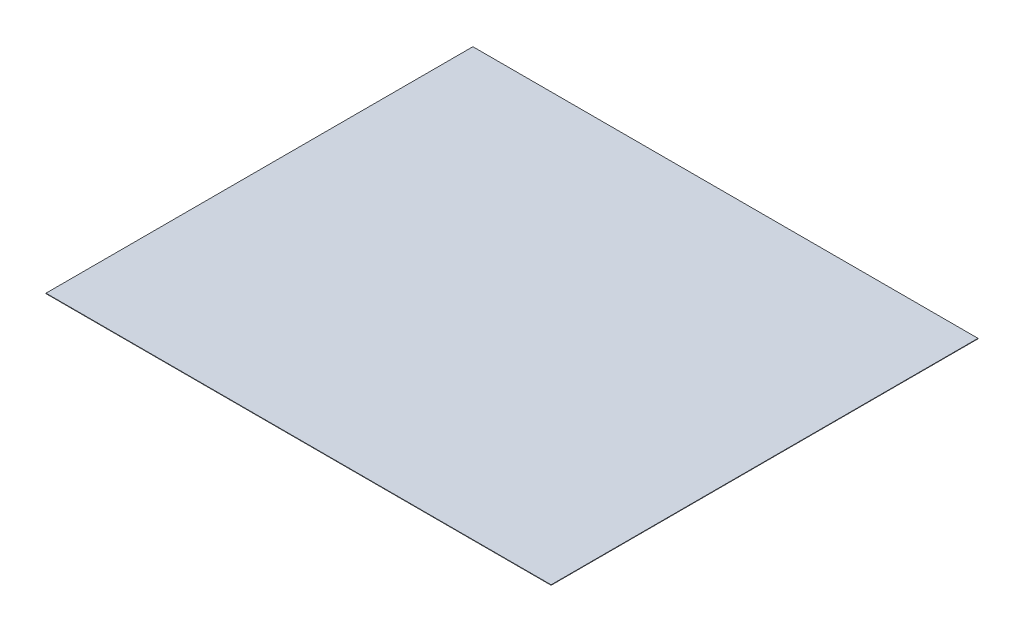
from build123d import *

# Parameters (mm, degrees)
SKETCH2_W           = 2260
SKETCH2_H           = 1910
BOSS_EXTRUDE1_DEPTH = 2


with BuildPart() as part:
    # Sketch2 → Boss-Extrude1 (new body)
    with BuildSketch(Plane(origin=(0, 0, 0), x_dir=(1, 0, 0), z_dir=(0, 1, 0))):
        with Locations((120.474427787, 8.1)):
            Rectangle(SKETCH2_W, SKETCH2_H)
    extrude(amount=BOSS_EXTRUDE1_DEPTH)


solid = part.part
